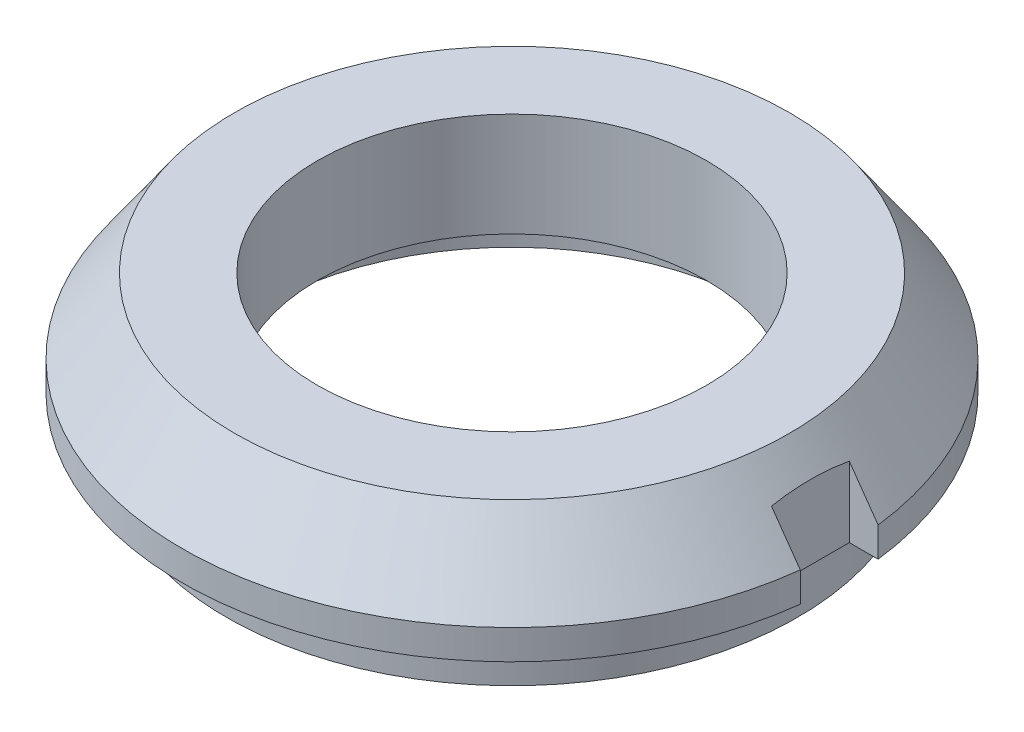
from build123d import *

# Parameters (mm, degrees)
CUT_EXTRUDE1_DEPTH = 19.936208702


with BuildPart() as part:
    # Sketch1 → Revolve1 (revolve)
    with BuildSketch(Plane.XY, mode=Mode.PRIVATE) as revolve1_sk:
        Polygon((-12.7, 2), (-11, 2), (-11, 0), (-9.7, 0), (-9.7, 2), (-7.5, 2), (-7.5, 6), (-10.7, 6), (-10.7, 3.143703987), (-12.7, 3.143703987), align=None)
        Polygon((-12.7, 3.143703987), (-10.7, 6), (-10.7, 3.143703987), align=None)
    revolve(revolve1_sk.sketch.rotate(Axis((0, 0, 0), (0, 1, 0)), 270), axis=Axis((0, 0, 0), (0, 1, 0)))

    # Sketch2 → Cut-Extrude1 (cut, through all)
    with BuildSketch(Plane(origin=(0, 0, 0), x_dir=(1, 0, 0), z_dir=(0, 1, 0))):
        with BuildLine():
            Line((-11.5, -1.5), (-11.5, 1.5))
            Line((-11.5, 1.5), (-12.611106216, 1.5))
            ThreePointArc((-12.611106216, 1.5), (-12.7, 0), (-12.611106216, -1.5))
            Line((-12.611106216, -1.5), (-11.5, -1.5))
        make_face()
        with BuildLine():
            ThreePointArc((12.7, 0), (12.677757076, 0.751315863), (12.611106216, 1.5))
            Line((12.611106216, 1.5), (11.5, 1.5))
            Line((11.5, 1.5), (11.5, -1.5))
            Line((11.5, -1.5), (12.611106216, -1.5))
            ThreePointArc((12.611106216, -1.5), (12.677757076, -0.751315863), (12.7, 0))
        make_face()
    extrude(amount=CUT_EXTRUDE1_DEPTH, mode=Mode.SUBTRACT)


solid = part.part
